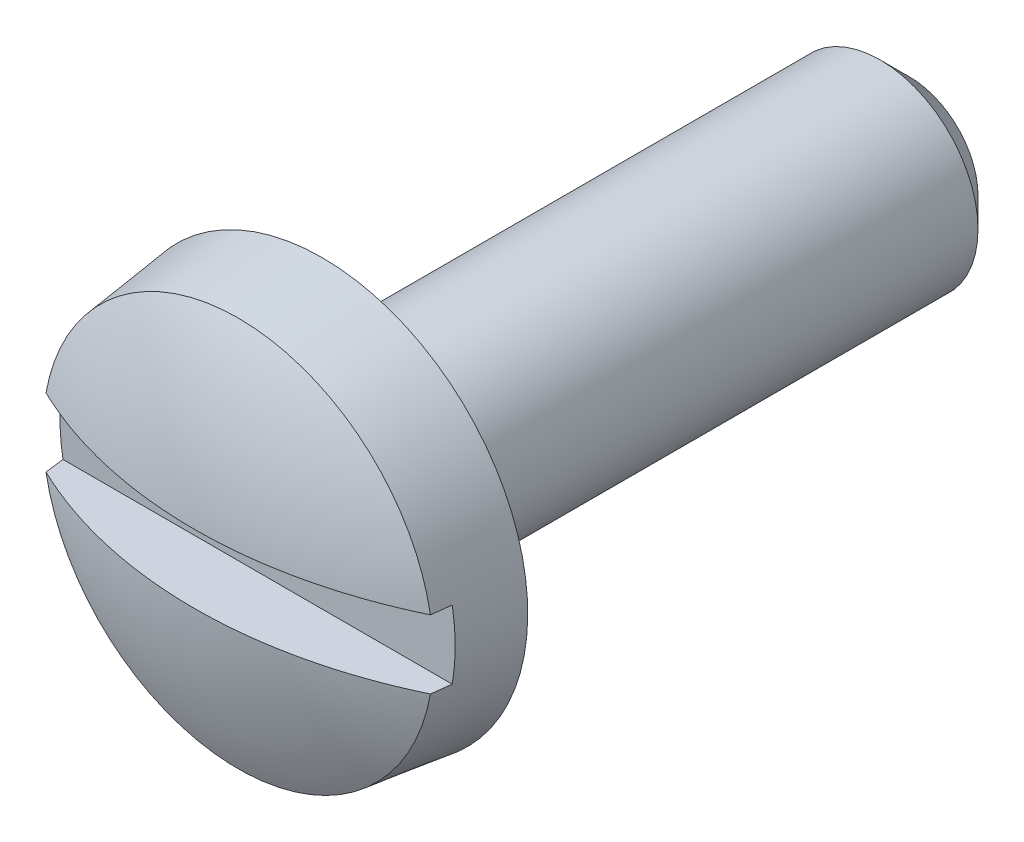
from build123d import *

# Parameters (mm, degrees)
SKETCH1_R       = 6.6675
EXTRUDE3_DEPTH  = 4.191
SKETCH4_W       = 19.05
SKETCH4_H       = 3.175
CHAMFER2_SIZE   = 0.9525
SKETCH31_W      = 13.335
SKETCH31_H      = 2.2225
EXTRUDE15_DEPTH = 2.0955


with BuildPart() as part:
    # Sketch1 → Extrude3 (new body)
    with BuildSketch(Plane.XY):
        Circle(SKETCH1_R)
    extrude(amount=EXTRUDE3_DEPTH)

    # Sketch11 → Cut-Revolve3 (revolve, cut)
    with BuildSketch(Plane(origin=(0, 0, 0), x_dir=(0, 0, -1), z_dir=(1, 0, 0))):
        with BuildLine():
            Line((-4.445, 6.9342), (0, 6.9342))
            Line((0, 6.9342), (0, 6.6675))
            Line((0, 6.6675), (-2.72415, 6.333016438))
            ThreePointArc((-2.72415, 6.333016438), (-3.819496854, 3.250336372), (-4.191, 0))
            Line((-4.191, 0), (-4.445, 0))
            Line((-4.445, 0), (-4.445, 6.9342))
        make_face()
    revolve(axis=Axis((0, 0, 0), (0, 0, 1)), mode=Mode.SUBTRACT)

    # Sketch31 → Extrude15 (cut)
    with BuildSketch(Plane.XY.offset(4.191)):
        Rectangle(SKETCH31_W, SKETCH31_H)
    extrude(amount=-EXTRUDE15_DEPTH, mode=Mode.SUBTRACT)


with BuildPart() as body_2:
    # Sketch4 → Revolve1 (revolve)
    with BuildSketch(Plane(origin=(0, 0, 0), x_dir=(0, 0, -1), z_dir=(1, 0, 0)), mode=Mode.PRIVATE) as revolve1_sk:
        with Locations((9.525, 1.5875)):
            Rectangle(SKETCH4_W, SKETCH4_H)
    revolve(revolve1_sk.sketch.rotate(Axis((0, 0, 0), (0, 0, -1)), 90), axis=Axis((0, 0, 0), (0, 0, -1)))

    # Chamfer2
    chamfer2_edges = [body_2.edges().sort_by_distance(p)[0] for p in [
        (-3.175, 0, -19.05),
    ]]
    chamfer(chamfer2_edges, length=CHAMFER2_SIZE)


solid = Compound([part.part, body_2.part])
